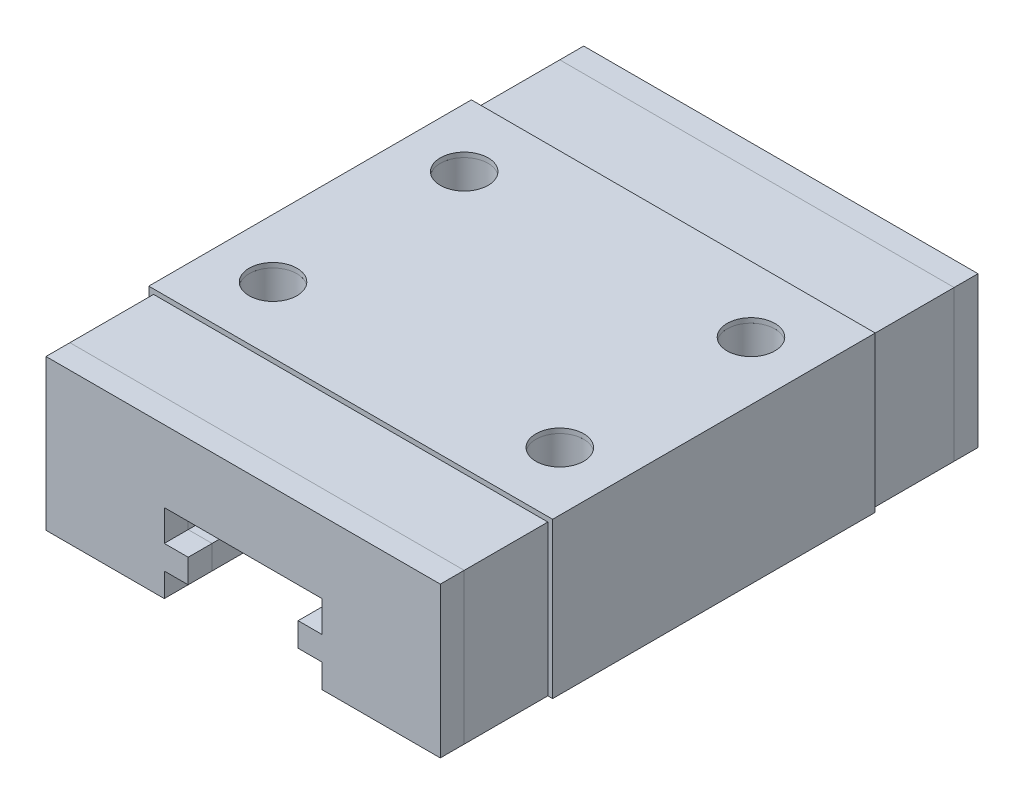
from build123d import *

# Parameters (mm, degrees)
EXTRUDE_1_DEPTH     = 1
EXTRUDE_2_DEPTH     = 20.5
EXTRUDE_3_DEPTH     = 1
FILLET_1_R          = 0.25
EXTRUDE_4_DEPTH     = 13.5
SKETCH_5_R          = 1
CUT_EXTRUDE_1_DEPTH = 4


with BuildPart() as part:
    # 草图1 → 凸台-拉伸1 (new body)
    with BuildSketch(Plane.XY):
        Polygon((0, 0), (0, 6.3), (16.5, 6.3), (16.5, 0), (11.55, 0), (11.55, 1), (10.55, 1), (10.55, 2), (11.55, 2), (11.55, 3.3), (4.95, 3.3), (4.95, 2), (5.95, 2), (5.95, 1), (4.95, 1), (4.95, 0), align=None)
    extrude(amount=EXTRUDE_1_DEPTH)

    # 圆角1
    fillet_1_edges = [part.edges().sort_by_distance(p)[0] for p in [
        (11.55, 0, 0.5),
        (11.55, 1, 0.5),
        (10.55, 1, 0.5),
        (10.55, 2, 0.5),
        (11.55, 2, 0.5),
        (11.55, 3.3, 0.5),
        (4.95, 3.3, 0.5),
        (4.95, 2, 0.5),
        (5.95, 2, 0.5),
        (5.95, 1, 0.5),
        (4.95, 1, 0.5),
        (4.95, 0, 0.5),
    ]]
    fillet(fillet_1_edges, radius=FILLET_1_R)


with BuildPart() as body_2:
    # 草图2 → 凸台-拉伸2 (new body)
    with BuildSketch(Plane.XY.offset(1)):
        Polygon((4.95, 0), (4.95, 1), (5.95, 1), (5.95, 2), (4.95, 2), (4.95, 3.3), (11.55, 3.3), (11.55, 2), (10.55, 2), (10.55, 1), (11.55, 1), (11.55, 0), (16.5, 0), (16.5, 6.3), (0, 6.3), (0, 0), align=None)
    extrude(amount=EXTRUDE_2_DEPTH)


with BuildPart() as body_3:
    # 草图3 → 凸台-拉伸3 (new body)
    with BuildSketch(Plane.XY.offset(21.5)):
        Polygon((0, 0), (4.95, 0), (4.95, 1), (5.95, 1), (5.95, 2), (4.95, 2), (4.95, 3.3), (11.55, 3.3), (11.55, 2), (10.55, 2), (10.55, 1), (11.55, 1), (11.55, 0), (16.5, 0), (16.5, 6.3), (0, 6.3), align=None)
    extrude(amount=EXTRUDE_3_DEPTH)


with BuildPart() as body_4:
    # 草图4 → 凸台-拉伸4 (new body)
    with BuildSketch(Plane.XY.offset(4.5)):
        Polygon((-0.2, 0), (0, 0), (0, 6.3), (16.5, 6.3), (16.5, 0), (16.7, 0), (16.7, 6.5), (-0.2, 6.5), align=None)
    extrude(amount=EXTRUDE_4_DEPTH)


with BuildPart() as cut_extrude_1_tool:
    # 草图5 → 切除-拉伸1 (new body)
    with BuildSketch(Plane(origin=(0, 6.5, 0), x_dir=(1, 0, 0), z_dir=(0, 1, 0))):
        with Locations(Location((2.25, -15.25, 0), (0, 0, 270))):
            Circle(SKETCH_5_R)
        with Locations(Location((14.25, -15.25, 0), (0, 0, 270))):
            Circle(SKETCH_5_R)
        with Locations(Location((14.25, -7.25, 0), (0, 0, 270))):
            Circle(SKETCH_5_R)
        with Locations(Location((2.25, -7.25, 0), (0, 0, 270))):
            Circle(SKETCH_5_R)
    extrude(amount=-CUT_EXTRUDE_1_DEPTH)


with BuildPart() as body_2_1:
    add(body_2.part)

    # 切除-拉伸1: cut by cut_extrude_1_tool
    add(cut_extrude_1_tool.part, mode=Mode.SUBTRACT)


with BuildPart() as body_4_1:
    add(body_4.part)

    # 切除-拉伸1: cut by cut_extrude_1_tool
    add(cut_extrude_1_tool.part, mode=Mode.SUBTRACT)


solid = Compound([part.part, body_3.part, body_2_1.part, body_4_1.part])
